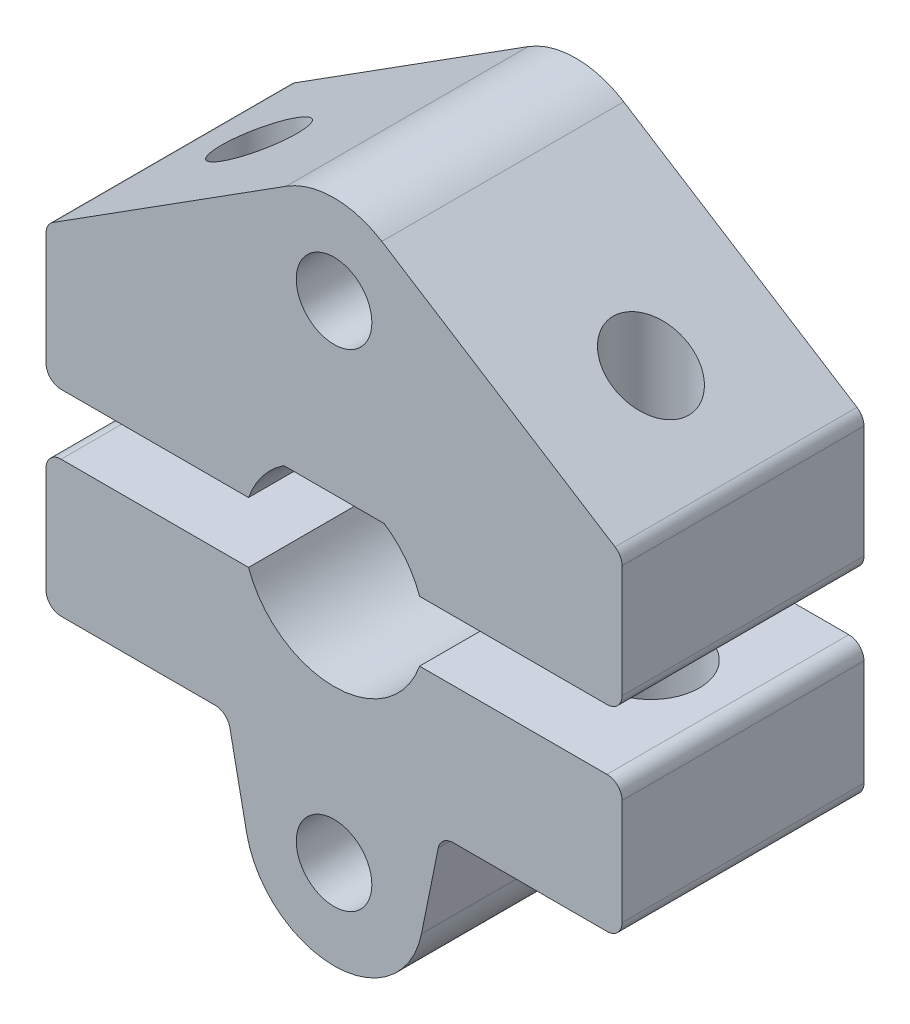
from build123d import *

# Parameters (mm, degrees)
SKETCH_1_R          = 1.25
EXTRUDE_1_DEPTH     = 8
EXTRUDE_1_2_DEPTH   = 8
SKETCH_2_R          = 1.25
CUT_EXTRUDE_1_DEPTH = 21.66397832
SKETCH_3_R          = 1.6
CUT_EXTRUDE_2_DEPTH = 4.5


with BuildPart() as part:
    # 草图1 → 凸台-拉伸1 (new body)
    with BuildSketch(Plane.XY):
        with BuildLine():
            Line((-1.658312395, 2.5), (1.658312395, 2.5))
            ThreePointArc((1.658312395, 2.5), (2.365419176, 1.84520788), (2.828427125, 1))
            Line((2.828427125, 1), (9.026279442, 1))
            ThreePointArc((9.026279442, 1), (9.379832832, 1.146446609), (9.526279442, 1.5))
            Line((9.526279442, 1.5), (9.526279442, 5.22507425))
            ThreePointArc((9.526279442, 5.22507425), (9.464414867, 5.465983671), (9.294130046, 5.647278056))
            Line((9.294130046, 5.647278056), (1.580318565, 10.541002455))
            ThreePointArc((1.580318565, 10.541002455), (0, 11), (-1.580318565, 10.541002455))
            Line((-1.580318565, 10.541002455), (-9.294130046, 5.647278056))
            ThreePointArc((-9.294130046, 5.647278056), (-9.464414867, 5.465983671), (-9.526279442, 5.22507425))
            Line((-9.526279442, 5.22507425), (-9.526279442, 1.5))
            ThreePointArc((-9.526279442, 1.5), (-9.379832832, 1.146446609), (-9.026279442, 1))
            Line((-9.026279442, 1), (-2.828427125, 1))
            ThreePointArc((-2.828427125, 1), (-2.365419176, 1.84520788), (-1.658312395, 2.5))
        make_face()
        with Locations((0, 8.05)):
            Circle(SKETCH_1_R, mode=Mode.SUBTRACT)
    extrude(amount=EXTRUDE_1_DEPTH)


with BuildPart() as body_2:
    # 草图1 → Extrude 1 2 (new body)
    with BuildSketch(Plane.XY):
        with BuildLine():
            Line((-9.026279442, -1), (-2.828427125, -1))
            ThreePointArc((-2.828427125, -1), (0, -3), (2.828427125, -1))
            Line((2.828427125, -1), (9.026279442, -1))
            ThreePointArc((9.026279442, -1), (9.379832832, -1.146446609), (9.526279442, -1.5))
            Line((9.526279442, -1.5), (9.526279442, -5))
            ThreePointArc((9.526279442, -5), (9.379832832, -5.353553391), (9.026279442, -5.5))
            Line((9.026279442, -5.5), (3.935174447, -5.5))
            ThreePointArc((3.935174447, -5.5), (3.6186464, -5.612947037), (3.445121974, -5.900760016))
            Line((3.445121974, -5.900760016), (2.891309587, -8.635515904))
            ThreePointArc((2.891309587, -8.635515904), (0, -11), (-2.891309587, -8.635515904))
            Line((-2.891309587, -8.635515904), (-3.445121974, -5.900760016))
            ThreePointArc((-3.445121974, -5.900760016), (-3.6186464, -5.612947037), (-3.935174447, -5.5))
            Line((-3.935174447, -5.5), (-9.026279442, -5.5))
            ThreePointArc((-9.026279442, -5.5), (-9.379832832, -5.353553391), (-9.526279442, -5))
            Line((-9.526279442, -5), (-9.526279442, -1.5))
            ThreePointArc((-9.526279442, -1.5), (-9.379832832, -1.146446609), (-9.026279442, -1))
        make_face()
        with Locations((0, -8.05)):
            Circle(SKETCH_1_R, mode=Mode.SUBTRACT)
    extrude(amount=EXTRUDE_1_2_DEPTH)


with BuildPart() as cut_extrude_1_tool:
    # 草图2 → 切除-拉伸1 (new, through all)
    with BuildSketch(Plane.XZ.offset(5.5)):
        with Locations(Location((6.480726944, 4, 0), (0, 0, 270))):
            Circle(SKETCH_2_R)
        with Locations(Location((-6.480726944, 4, 0), (0, 0, 270))):
            Circle(SKETCH_2_R)
    extrude(amount=-CUT_EXTRUDE_1_DEPTH)


with BuildPart() as part_1:
    add(part.part)

    # 切除-拉伸1: cut by cut_extrude_1_tool
    add(cut_extrude_1_tool.part, mode=Mode.SUBTRACT)


with BuildPart() as body_2_1:
    add(body_2.part)

    # 切除-拉伸1: cut by cut_extrude_1_tool
    add(cut_extrude_1_tool.part, mode=Mode.SUBTRACT)

    # 草图3 → 切除-拉伸2 (cut)
    with BuildSketch(Plane.XZ.offset(5.5)):
        with Locations(Location((-6.480726944, 4, 0), (0, 0, 270))):
            Circle(SKETCH_3_R)
        with Locations(Location((6.480726944, 4, 0), (0, 0, 270))):
            Circle(SKETCH_3_R)
    extrude(amount=-CUT_EXTRUDE_2_DEPTH, mode=Mode.SUBTRACT)


solid = Compound([part_1.part, body_2_1.part])
